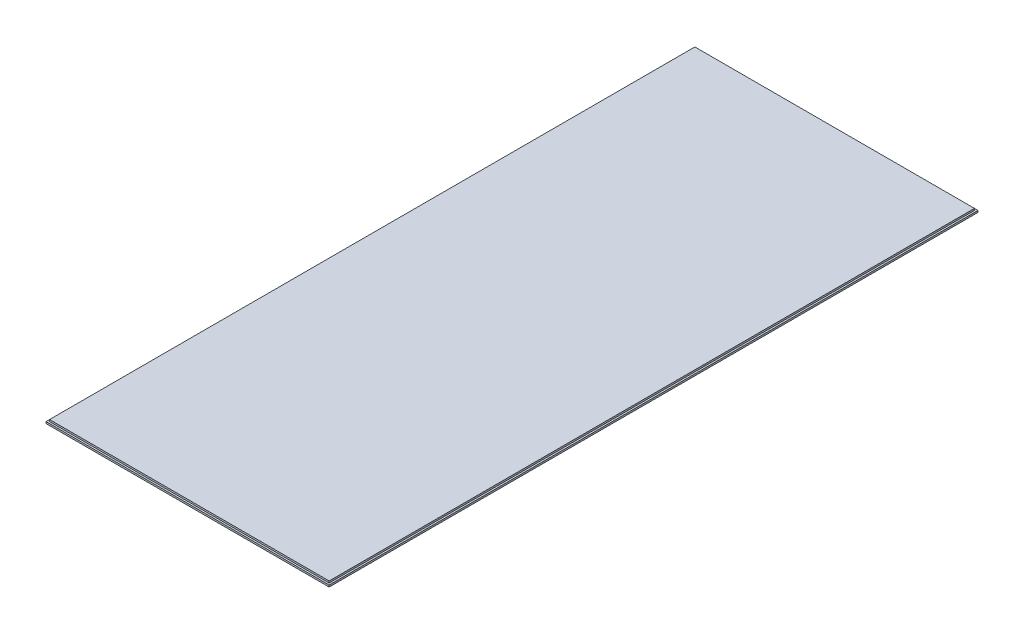
from build123d import *

# Parameters (mm, degrees)
SKETCH1_W           = 190.5
SKETCH1_H           = 436.5625
BOSS_EXTRUDE1_DEPTH = 1.190625
SKETCH2_W           = 188.11875
SKETCH2_H           = 434.18125
BOSS_EXTRUDE2_DEPTH = 1.190625


with BuildPart() as part:
    # Sketch1 → Boss-Extrude1 (new body)
    with BuildSketch(Plane(origin=(0, 0, 0), x_dir=(1, 0, 0), z_dir=(0, 1, 0))):
        with Locations((35.913816213, 164.078893724)):
            Rectangle(SKETCH1_W, SKETCH1_H)
    extrude(amount=BOSS_EXTRUDE1_DEPTH)

    # Sketch2 → Boss-Extrude2 (add)
    with BuildSketch(Plane(origin=(0, 1.190625, 0), x_dir=(1, 0, 0), z_dir=(0, 1, 0))):
        with Locations((35.913816213, 164.078893724)):
            Rectangle(SKETCH2_W, SKETCH2_H)
    extrude(amount=BOSS_EXTRUDE2_DEPTH)


solid = part.part
